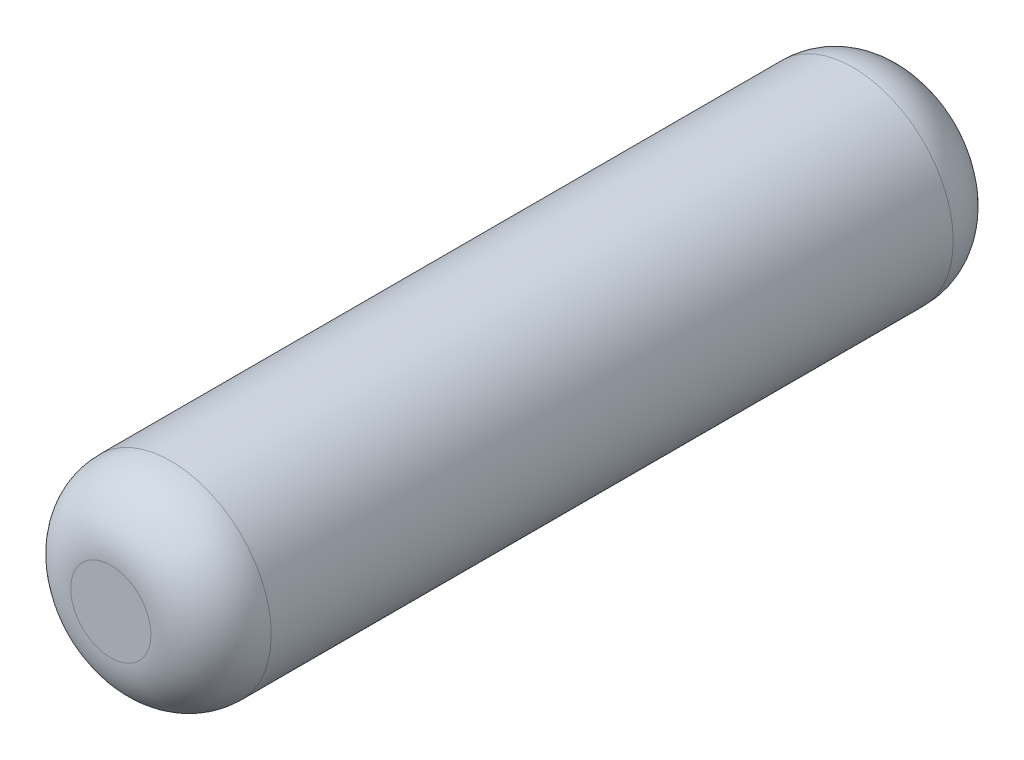
from build123d import *

# Parameters (mm, degrees)
SKETCH1_R           = 5
BOSS_EXTRUDE1_DEPTH = 40
FILLET3_R           = 3
FILLET4_R           = 3


with BuildPart() as part:
    # Sketch1 → Boss-Extrude1 (new body)
    with BuildSketch(Plane.XY):
        Circle(SKETCH1_R)
    extrude(amount=BOSS_EXTRUDE1_DEPTH)

    # Fillet3
    fillet3_edges = [part.edges().sort_by_distance(p)[0] for p in [
        (-5, 0, 40),
    ]]
    fillet(fillet3_edges, radius=FILLET3_R)

    # Fillet4
    fillet4_edges = [part.edges().sort_by_distance(p)[0] for p in [
        (-5, 0, 0),
    ]]
    fillet(fillet4_edges, radius=FILLET4_R)


solid = part.part
